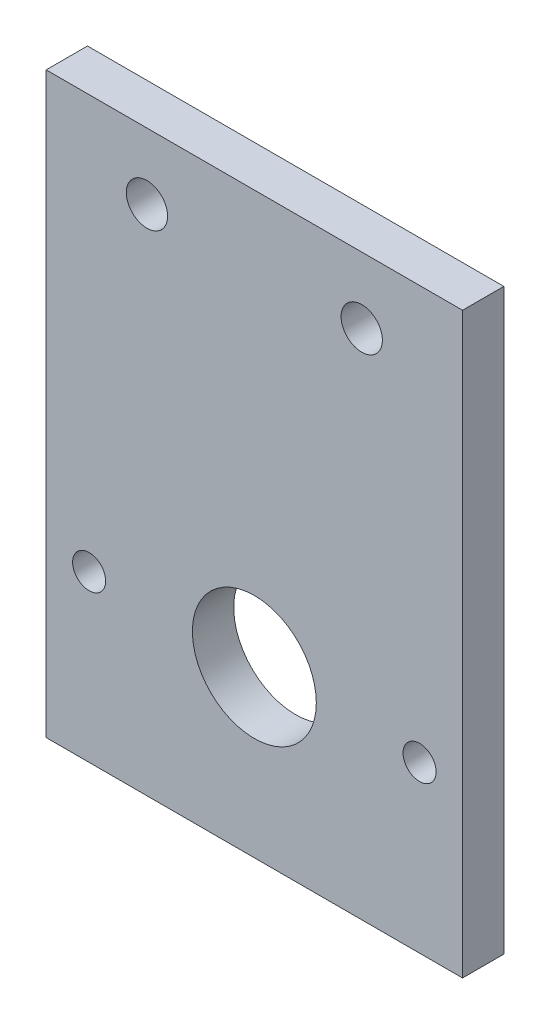
from build123d import *

# Parameters (mm, degrees)
SKETCH1_W      = 64.008
SKETCH1_H      = 88.9
EXTRUDE1_DEPTH = 6.35
SKETCH2_R      = 2.54
EXTRUDE2_DEPTH = 56.139650126
SKETCH3_R      = 9.525
EXTRUDE4_DEPTH = 56.139650126
SKETCH4_R      = 3.175
EXTRUDE5_DEPTH = 56.139650126


with BuildPart() as part:
    # Sketch1 → Extrude1 (new body)
    with BuildSketch(Plane.XY):
        Rectangle(SKETCH1_W, SKETCH1_H)
    extrude(amount=EXTRUDE1_DEPTH)

    # Sketch2 → Extrude2 (cut, through all)
    with BuildSketch(Plane.XY.offset(6.35)):
        with Locations((-25.4, -19.05)):
            Circle(SKETCH2_R)
        with Locations(Location((25.4, -19.05, 0), (0, 0, 180))):
            Circle(SKETCH2_R)
    extrude(amount=-EXTRUDE2_DEPTH, mode=Mode.SUBTRACT)

    # Sketch3 → Extrude4 (cut, through all)
    with BuildSketch(Plane.XY.offset(6.35)):
        with Locations((0, -19.05)):
            Circle(SKETCH3_R)
    extrude(amount=-EXTRUDE4_DEPTH, mode=Mode.SUBTRACT)

    # Sketch4 → Extrude5 (cut, through all)
    with BuildSketch(Plane.XY.offset(6.35)):
        with Locations((-16.51, 34.29)):
            Circle(SKETCH4_R)
        with Locations(Location((16.51, 34.29, 0), (0, 0, 180))):
            Circle(SKETCH4_R)
    extrude(amount=-EXTRUDE5_DEPTH, mode=Mode.SUBTRACT)


solid = part.part
